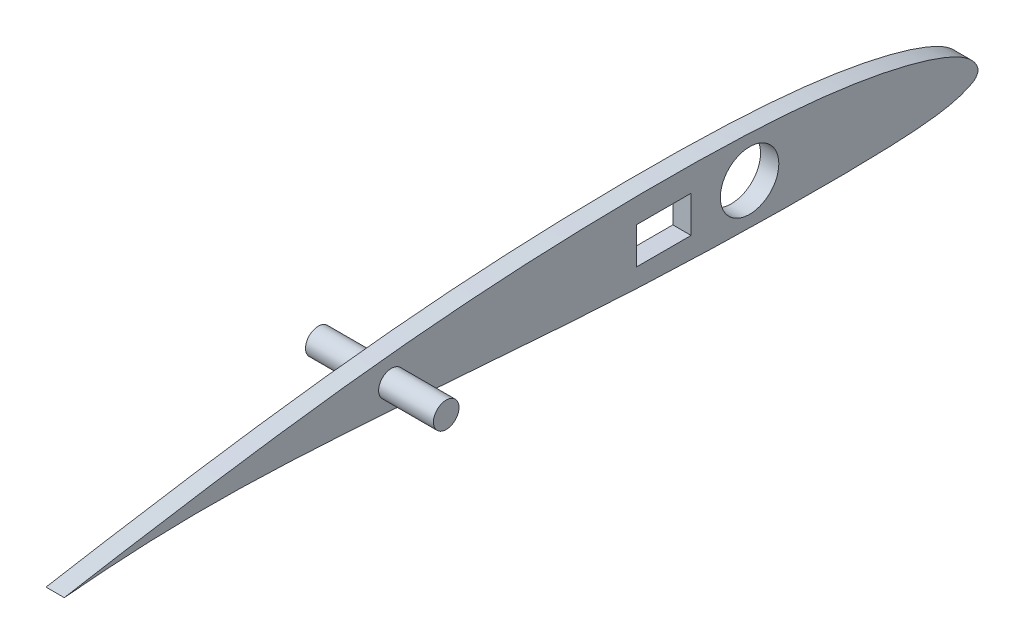
from build123d import *

# Parameters (mm, degrees)
SCHIZZO1_R               = 8
SCHIZZO1_W               = 15
SCHIZZO1_H               = 10
CORPOFOAM_DEPTH          = 5
PERNOAGGANCIO_DEPTH      = 15
PERNOAGGANCIO_DEPTH_BACK = 20
SCHIZZO2_R               = 3.5


with BuildPart() as part:
    # Schizzo1 → CorpoFoam (new body)
    with BuildSketch(Plane(origin=(0, 0, 0), x_dir=(0, 0, -1), z_dir=(1, 0, 0))):
        with BuildLine():
            add(Edge.make_bspline(
                [(-250, 0), (-250.000228294, -0.008042796), (-248.284955516, 0.172375658), (-246.518112419, 0.308690015), (-242.189387343, 0.685693594), (-236.806461263, 1.074101529), (-229.680385952, 1.49731724), (-221.184158698, 1.823218603), (-211.337618208, 1.967626101), (-200.371188527, 1.833221056), (-188.499913622, 1.38960529), (-175.953687417, 0.706014078), (-162.931424918, -0.160208642), (-149.615771744, -1.148016327), (-136.176354995, -2.19092491), (-122.767140548, -3.219583979), (-109.520053587, -4.152743127), (-96.546095975, -4.938564365), (-83.940819302, -5.536830703), (-71.801839291, -5.947648205), (-60.245256003, -6.218450939), (-49.398732891, -6.355369756), (-39.397226194, -6.381387963), (-30.361934842, -6.26504923), (-22.412181103, -6.012164917), (-15.626227231, -5.597433901), (-10.071907511, -4.928706579), (-5.697692612, -4.040446981), (-2.625320639, -2.865752984), (-0.494884225, -1.71152847), (0.021312549, -0.410454231), (-0.0311692, 0.792659827), (-0.812599242, 2.305684337), (-2.728863517, 4.238352424), (-5.769907241, 6.118172121), (-9.880942804, 7.913594202), (-15.074930468, 9.641318178), (-21.298752222, 11.283896488), (-28.49717212, 12.788381759), (-36.607373406, 14.097834908), (-45.57302844, 15.159429017), (-55.332910074, 15.960903998), (-65.816536498, 16.494069738), (-76.93137626, 16.791989705), (-88.566949028, 16.864754131), (-100.596999886, 16.726715291), (-112.888825982, 16.383385064), (-125.311615819, 15.825573667), (-137.743791097, 15.05233187), (-150.072384382, 14.059339074), (-162.191375056, 12.881586986), (-173.989074322, 11.549280346), (-185.352364446, 10.116249729), (-196.163081698, 8.632379125), (-206.300441402, 7.131513884), (-215.560350587, 5.731221768), (-223.977157043, 4.293295127), (-231.363413336, 3.181808874), (-237.746440904, 2.098942417), (-242.622069366, 1.245861917), (-246.644529332, 0.552864946), (-248.32839844, 0.246216765), (-249.999773563, 0.007977377), (-250, 0)],
                knots=[0, 0, 0, 0, 0.001588889, 0.006329218, 0.014202456, 0.025172808, 0.039173483, 0.056060631, 0.075578924, 0.097363607, 0.120926258, 0.145825281, 0.171670912, 0.198108537, 0.224790184, 0.25139058, 0.277643491, 0.30332675, 0.328257458, 0.352272548, 0.375156062, 0.396620664, 0.416422729, 0.43430442, 0.45005468, 0.463465465, 0.474478994, 0.483169222, 0.489678354, 0.494104066, 0.496910015, 0.497289785, 0.501214273, 0.50645795, 0.513356957, 0.522168632, 0.53296597, 0.545689209, 0.560220779, 0.576438923, 0.594258689, 0.613600245, 0.634342386, 0.656331109, 0.679351894, 0.703152303, 0.727478208, 0.752070739, 0.776691164, 0.801140184, 0.825214387, 0.848697424, 0.871352858, 0.892947449, 0.913230871, 0.931955467, 0.948342069, 0.963693004, 0.976235918, 0.986320059, 0.993788799, 0.998424035, 1, 1, 1, 1], degree=3))
        make_face()
        with Locations((-62.499919709, 5.077322704)):
            Circle(SCHIZZO1_R, mode=Mode.SUBTRACT)
        with Locations((-85.999919709, 5.077322704)):
            Rectangle(SCHIZZO1_W, SCHIZZO1_H, mode=Mode.SUBTRACT)
    extrude(amount=CORPOFOAM_DEPTH)

    # Schizzo2 → PernoAggancio (add, two sides: drawn at the far end of the back side and taken through both)
    with BuildSketch(Plane.ZY.offset(-PERNOAGGANCIO_DEPTH_BACK)):
        with Locations((160.499919709, 6.077322704)):
            Circle(SCHIZZO2_R)
    extrude(amount=PERNOAGGANCIO_DEPTH + PERNOAGGANCIO_DEPTH_BACK)


solid = part.part
